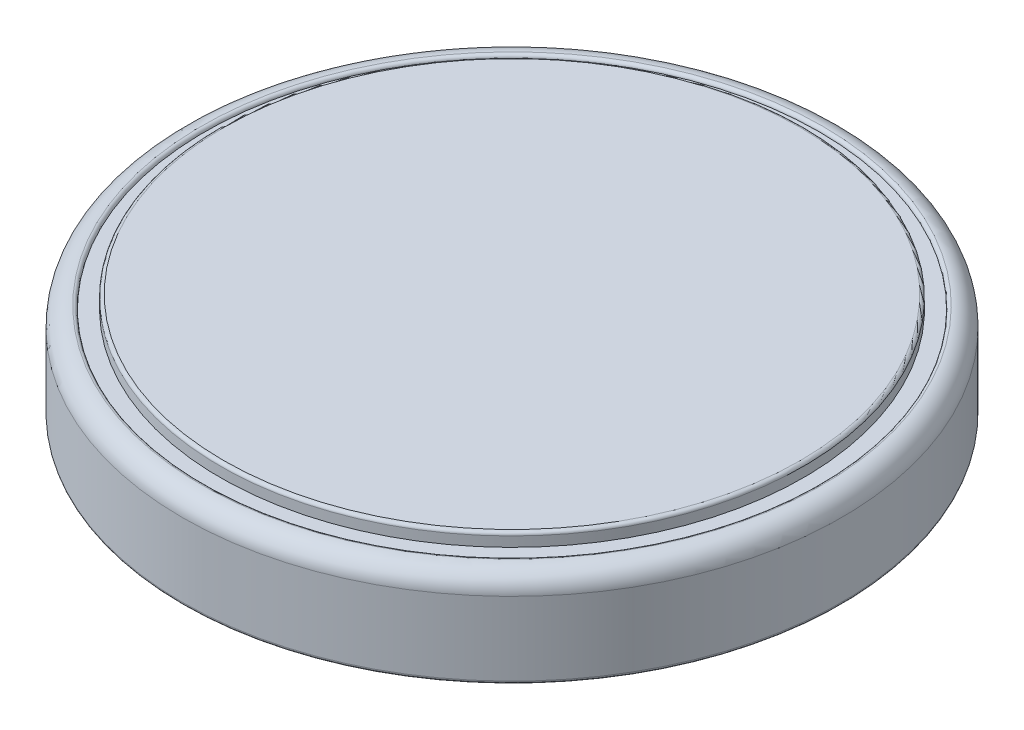
from build123d import *

# Parameters (mm, degrees)
FILLET1_R = 0.1


with BuildPart() as part:
    # Sketch1 → Revolve1 (revolve)
    with BuildSketch(Plane.XY, mode=Mode.PRIVATE) as revolve1_sk:
        with BuildLine():
            Line((0, 0), (10, 0))
            Line((10, 0), (10, 2.325))
            ThreePointArc((10, 2.325), (9.831586399, 2.731586399), (9.425, 2.9))
            ThreePointArc((9.425, 2.9), (9.354289322, 2.870710678), (9.325, 2.8))
            Line((9.325, 2.8), (8.85, 2.8))
            Line((8.85, 2.8), (8.85, 3.1))
            ThreePointArc((8.85, 3.1), (8.820710678, 3.170710678), (8.75, 3.2))
            Line((8.75, 3.2), (0, 3.2))
            Line((0, 3.2), (0, 0))
        make_face()
    revolve(revolve1_sk.sketch.rotate(Axis((0, 0, 0), (0, 1, 0)), 90), axis=Axis((0, 0, 0), (0, 1, 0)))

    # Fillet1
    fillet1_edges = [part.edges().sort_by_distance(p)[0] for p in [
        (0, 0, 10),
    ]]
    fillet(fillet1_edges, radius=FILLET1_R)


solid = part.part
